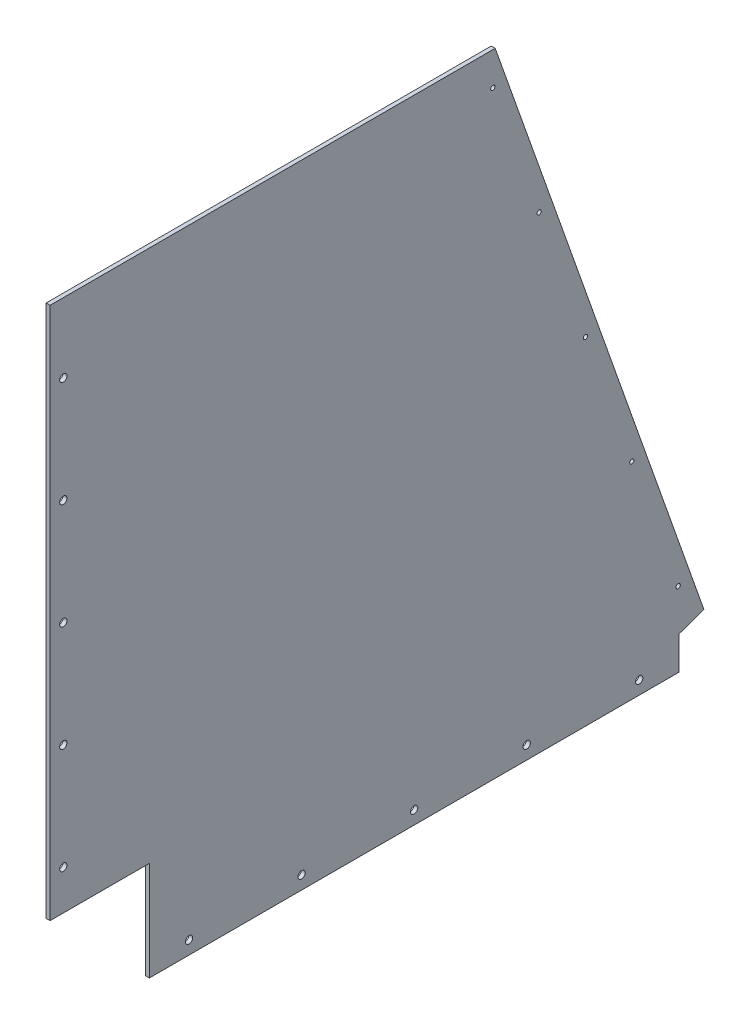
from build123d import *

# Parameters (mm, degrees)
BOSS_EXTRUDE1_DEPTH        = 3
SKETCH2_W                  = 50
SKETCH2_H                  = 50
CUT_EXTRUDE1_DEPTH         = 10
SKETCH3_W                  = 3
SKETCH3_H                  = 480
BOSS_EXTRUDE2_DEPTH        = 20
SKETCH5_W                  = 3
SKETCH5_H                  = 400
BOSS_EXTRUDE3_DEPTH        = 25
SKETCH6_W                  = 3
SKETCH6_H                  = 402.54833996
BOSS_EXTRUDE4_DEPTH        = 25
SKETCH7_W                  = 25.200898878
SKETCH7_H                  = 14.317309472
CUT_EXTRUDE2_DEPTH         = 25
F_3_2_3_2_DIAMETER_HOLE1_D = 3.2
F_5_5_5_5_DIAMETER_HOLE1_D = 5.5


with BuildPart() as part:
    # Sketch1 → Boss-Extrude1 (new body)
    with BuildSketch(Plane(origin=(0, 0, 0), x_dir=(0, 0, -1), z_dir=(1, 0, 0))):
        Polygon((31.669668796, 625.573683549), (191.669668796, 173.025343589), (-258.330331204, 173.025343589), (-258.330331204, 625.573683549), align=None)
    extrude(amount=BOSS_EXTRUDE1_DEPTH)

    # Sketch2 → Cut-Extrude1 (cut)
    with BuildSketch(Plane.ZY):
        with Locations((233.330331204, 198.025343589)):
            Rectangle(SKETCH2_W, SKETCH2_H)
    extrude(amount=-CUT_EXTRUDE1_DEPTH, mode=Mode.SUBTRACT)

    # Sketch3 → Boss-Extrude2 (add)
    with BuildSketch(Plane(origin=(0, 79.461003756, -224.749658383), x_dir=(-1, 0, 0), z_dir=(0, 0.3333333333333335, -0.9428090415820635))):
        with Locations((-1.5, 339.23996876)):
            Rectangle(SKETCH3_W, SKETCH3_H)
    extrude(amount=BOSS_EXTRUDE2_DEPTH)

    # Sketch5 → Boss-Extrude3 (add)
    with BuildSketch(Plane.XZ.offset(-173.025343589)):
        with Locations((1.5, 8.330331204)):
            Rectangle(SKETCH5_W, SKETCH5_H)
    extrude(amount=BOSS_EXTRUDE3_DEPTH)

    # Sketch6 → Boss-Extrude4 (add)
    with BuildSketch(Plane.XY.offset(258.330331204)):
        with Locations((1.5, 424.299513569)):
            Rectangle(SKETCH6_W, SKETCH6_H)
    extrude(amount=BOSS_EXTRUDE4_DEPTH)

    # Sketch7 → Cut-Extrude2 (cut)
    with BuildSketch(Plane(origin=(3, 0, 0), x_dir=(0, 0, -1), z_dir=(1, 0, 0))):
        with Locations((44.270118235, 632.732338285)):
            Rectangle(SKETCH7_W, SKETCH7_H)
    extrude(amount=-CUT_EXTRUDE2_DEPTH, mode=Mode.SUBTRACT)

    # Ø3.2 (3.2) Diameter Hole1 (through all)
    with Locations(Plane(origin=(3, 0, 0), x_dir=(0, 0, -1), z_dir=(1, 0, 0))):
        with Locations((191.097759212, 204.64294817), (156.097759212, 303.637897536), (121.097759212, 402.632846902), (86.097759212, 501.627796268), (51.097759212, 600.622745635)):
            Hole(F_3_2_3_2_DIAMETER_HOLE1_D / 2)

    # Ø5.5 (5.5) Diameter Hole1 (through all)
    with Locations(Plane(origin=(3, 0, 0), x_dir=(0, 0, -1), z_dir=(1, 0, 0))):
        with Locations((161.669668796, 158.025343589), (76.669668796, 158.025343589), (-8.330331204, 158.025343589), (-93.330331204, 158.025343589), (-178.330331204, 158.025343589), (-273.330331204, 253.025343589), (-273.330331204, 333.025343589), (-273.330331204, 413.025343589), (-273.330331204, 493.025343589), (-273.330331204, 573.025343589)):
            Hole(F_5_5_5_5_DIAMETER_HOLE1_D / 2)


solid = part.part
